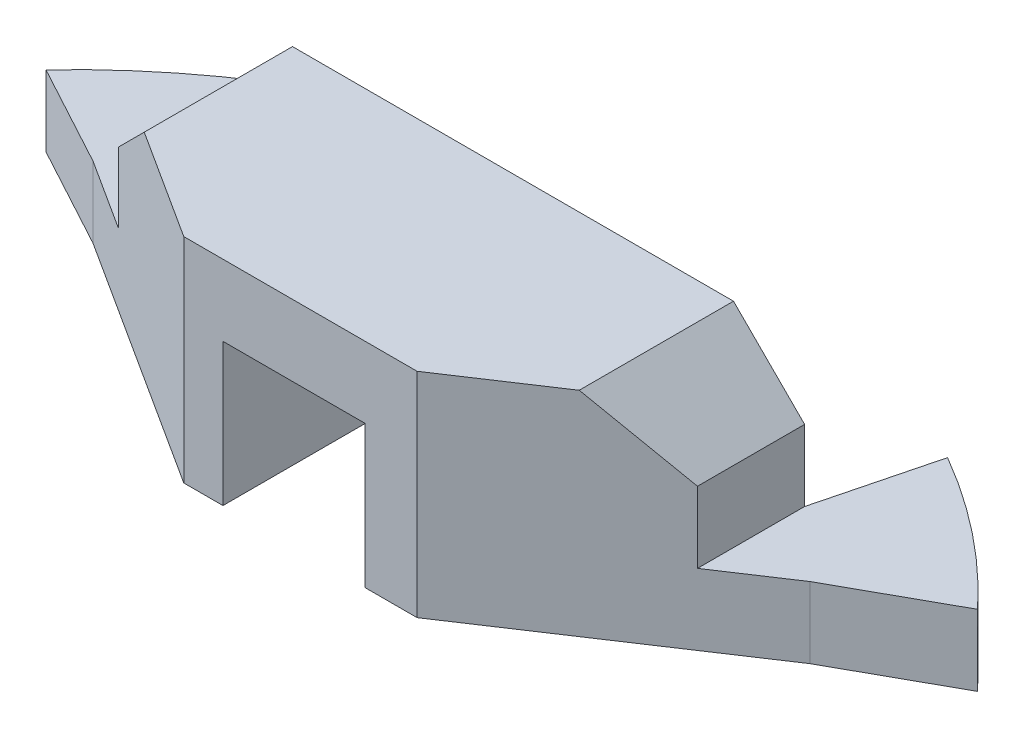
from build123d import *

# Parameters (mm, degrees)
BOSS_EXTRUDE1_DEPTH = 30
CUT_EXTRUDE1_DEPTH  = 20
CHAMFER1_SIZE       = 10
SKETCH4_W           = 20
SKETCH4_H           = 20
CUT_EXTRUDE2_DEPTH  = 41.358334189


with BuildPart() as part:
    # Sketch1 → Boss-Extrude1 (new body)
    with BuildSketch(Plane(origin=(0, 0, 0), x_dir=(1, 0, 0), z_dir=(0, 1, 0))):
        with BuildLine():
            Line((-65.495262312, 61.728199509), (-51.064892932, 53.913448014))
            Line((-51.064892932, 53.913448014), (-15.510423608, 31.112009379))
            Line((-15.510423608, 31.112009379), (17.288542893, 31.112009379))
            Line((17.288542893, 31.112009379), (50.510402672, 53.128986682))
            Line((50.510402672, 53.128986682), (65.676291813, 61.535556337))
            ThreePointArc((65.676291813, 61.535556337), (55.986333501, 70.466520143), (45.096073772, 77.886739118))
            Line((45.096073772, 77.886739118), (41, 61.886739118))
            Line((41, 61.886739118), (-41, 61.886739118))
            Line((-41, 61.886739118), (-45.096073772, 77.886739118))
            ThreePointArc((-45.096073772, 77.886739118), (-55.882783617, 70.548667565), (-65.495262312, 61.728199509))
        make_face()
    extrude(amount=BOSS_EXTRUDE1_DEPTH)

    # Sketch3 → Cut-Extrude1 (cut)
    with BuildSketch(Plane(origin=(0, 30, 0), x_dir=(1, 0, 0), z_dir=(0, 1, 0))):
        Polygon((41, 61.886739118), (41, 39.992019881), (77.260525415, 39.992019881), (80.602533751, 99.084803638), (39.738886371, 90.425963859), align=None)
    cut_extrude1 = extrude(amount=-CUT_EXTRUDE1_DEPTH, mode=Mode.SUBTRACT)

    # Mirror1: Cut-Extrude1 across plane
    add(cut_extrude1.mirror(Plane(origin=(0, 0, 0), x_dir=(0, 0, 1), z_dir=(1, 0, 0))), mode=Mode.SUBTRACT)

    # Chamfer1
    chamfer1_edges = [part.edges().sort_by_distance(p)[0] for p in [
        (41, 30, -54.356469192),
        (-41, 30, -54.672735052),
    ]]
    chamfer(chamfer1_edges, length=CHAMFER1_SIZE)

    # Sketch4 → Cut-Extrude2 (cut)
    with BuildSketch(Plane(origin=(0, 0, -61.886739118), x_dir=(-1, 0, 0), z_dir=(0, 0, -1))):
        with Locations((0, 10)):
            Rectangle(SKETCH4_W, SKETCH4_H)
    extrude(amount=-CUT_EXTRUDE2_DEPTH, mode=Mode.SUBTRACT)


solid = part.part
